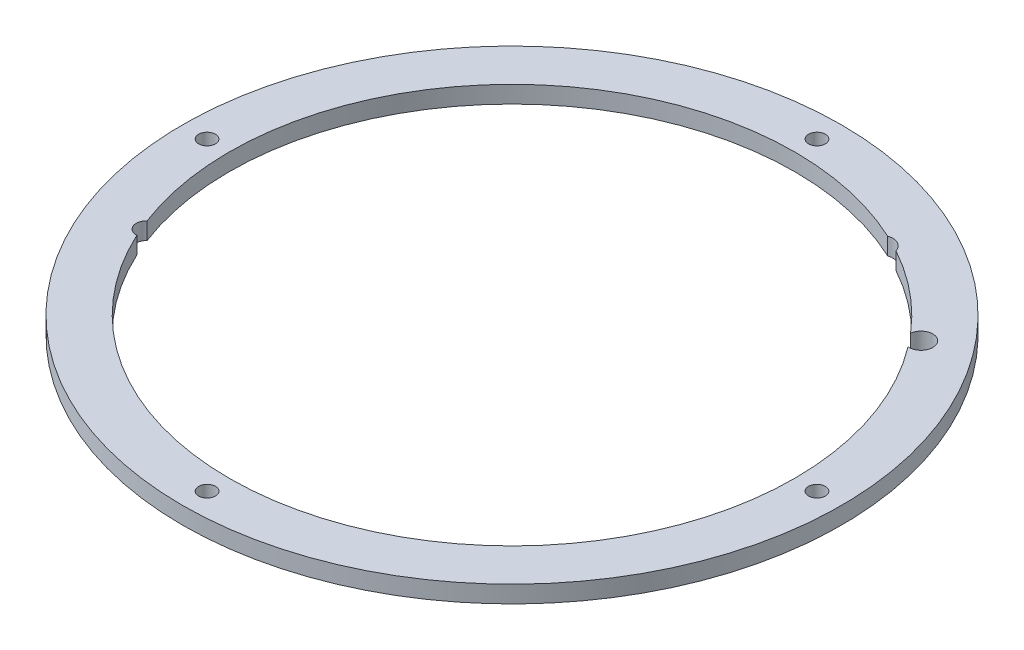
from build123d import *

# Parameters (mm, degrees)
SKETCH_1_R          = 102
SKETCH_1_R_2        = 87.5
SKETCH_1_R_3        = 2.6
EXTRUDE_1_DEPTH     = 5.3
SKETCH_2_R          = 3.65
SKETCH_2_R_2        = 3.15
SKETCH_2_R_3        = 4
CUT_EXTRUDE_1_DEPTH = 145.347116355


with BuildPart() as part:
    # 草图1 → 凸台-拉伸1 (new body)
    with BuildSketch(Plane(origin=(0, 0, 0), x_dir=(1, 0, 0), z_dir=(0, 1, 0))):
        with Locations(Location((0, 0, 0), (0, 0, 270))):
            Circle(SKETCH_1_R)
        with Locations(Location((0, 0, 0), (0, 0, 270))):
            Circle(SKETCH_1_R_2, mode=Mode.SUBTRACT)
        with Locations(Location((0, 94.385, 0), (0, 0, 270))):
            Circle(SKETCH_1_R_3, mode=Mode.SUBTRACT)
        with Locations(Location((94.385, 0, 0), (0, 0, 270))):
            Circle(SKETCH_1_R_3, mode=Mode.SUBTRACT)
        with Locations(Location((0, -94.385, 0), (0, 0, 270))):
            Circle(SKETCH_1_R_3, mode=Mode.SUBTRACT)
        with Locations(Location((-94.385, 0, 0), (0, 0, 270))):
            Circle(SKETCH_1_R_3, mode=Mode.SUBTRACT)
    extrude(amount=EXTRUDE_1_DEPTH)

    # 草图2 → 切除-拉伸1 (cut, through all)
    with BuildSketch(Plane.XZ):
        with Locations((70.154572481, -56.436700926)):
            Circle(SKETCH_2_R)
        with Locations((-79.620223562, 33.516861428)):
            Circle(SKETCH_2_R_2)
        with Locations((38.336469882, -75.530286573)):
            Circle(SKETCH_2_R_3)
    extrude(amount=-CUT_EXTRUDE_1_DEPTH, mode=Mode.SUBTRACT)


solid = part.part
